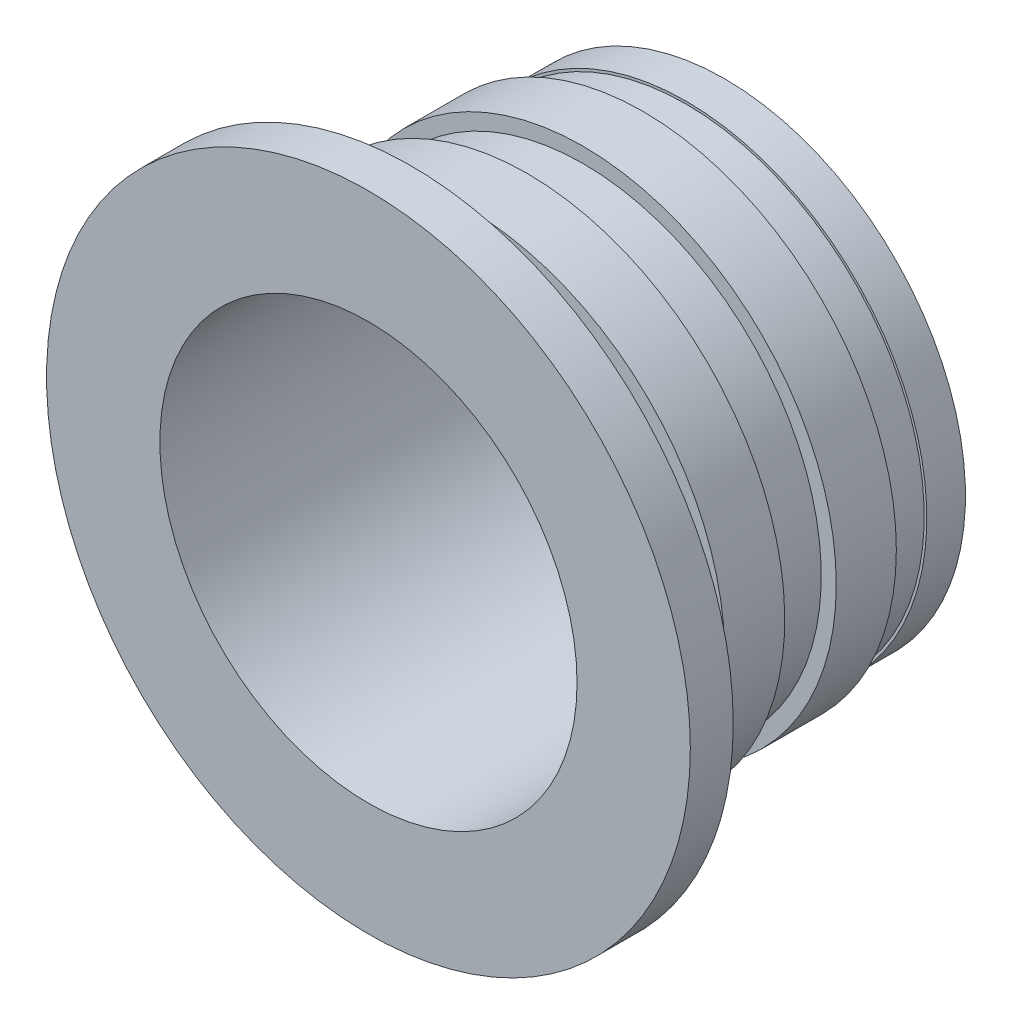
from build123d import *

# Parameters (mm, degrees)
SKETCH1_R           = 9.525
BOSS_EXTRUDE1_DEPTH = 1.27
SKETCH2_R           = 8.3185
BOSS_EXTRUDE2_DEPTH = 10.541
SKETCH3_R           = 6.1722
CUT_EXTRUDE1_DEPTH  = 9.652
SKETCH4_R           = 1.27
CUT_EXTRUDE2_DEPTH  = 17.571431863


with BuildPart() as part:
    # Sketch1 → Boss-Extrude1 (new body)
    with BuildSketch(Plane.XY):
        Circle(SKETCH1_R)
    extrude(amount=BOSS_EXTRUDE1_DEPTH)

    # Sketch2 → Boss-Extrude2 (add)
    with BuildSketch(Plane(origin=(0, 0, 1.27), x_dir=(-1, 0, 0), z_dir=(0, 0, -1))):
        Circle(SKETCH2_R)
    extrude(amount=BOSS_EXTRUDE2_DEPTH)

    # Sketch3 → Cut-Extrude1 (cut)
    with BuildSketch(Plane.XY.offset(1.27)):
        Circle(SKETCH3_R)
    extrude(amount=-CUT_EXTRUDE1_DEPTH, mode=Mode.SUBTRACT)

    # Sketch4 → Cut-Extrude2 (cut, through all)
    with BuildSketch(Plane.XY.offset(-8.382)):
        with Locations((0, 3.937)):
            Circle(SKETCH4_R)
        with Locations(Location((0, -3.937, 0), (0, 0, 180))):
            Circle(SKETCH4_R)
    extrude(amount=-CUT_EXTRUDE2_DEPTH, mode=Mode.SUBTRACT)

    # Sketch5 → Cut-Revolve1 (revolve, cut)
    with BuildSketch(Plane(origin=(0, 0, 0), x_dir=(0, 0, -1), z_dir=(1, 0, 0))):
        Polygon((0, 7.1247), (0, 9.525), (9.271, 9.525), (9.271, 7.1247), (8.128, 7.1247), (8.128, 7.0485), (6.858, 7.0485), (6.858, 7.493), (5.08, 7.493), (5.08, 7.0485), (3.429, 7.0485), (3.429, 7.62), (1.651, 7.62), (1.651, 7.1247), align=None)
    revolve(axis=Axis((0, 0, 0), (0, 0, 1)), mode=Mode.SUBTRACT)


solid = part.part
